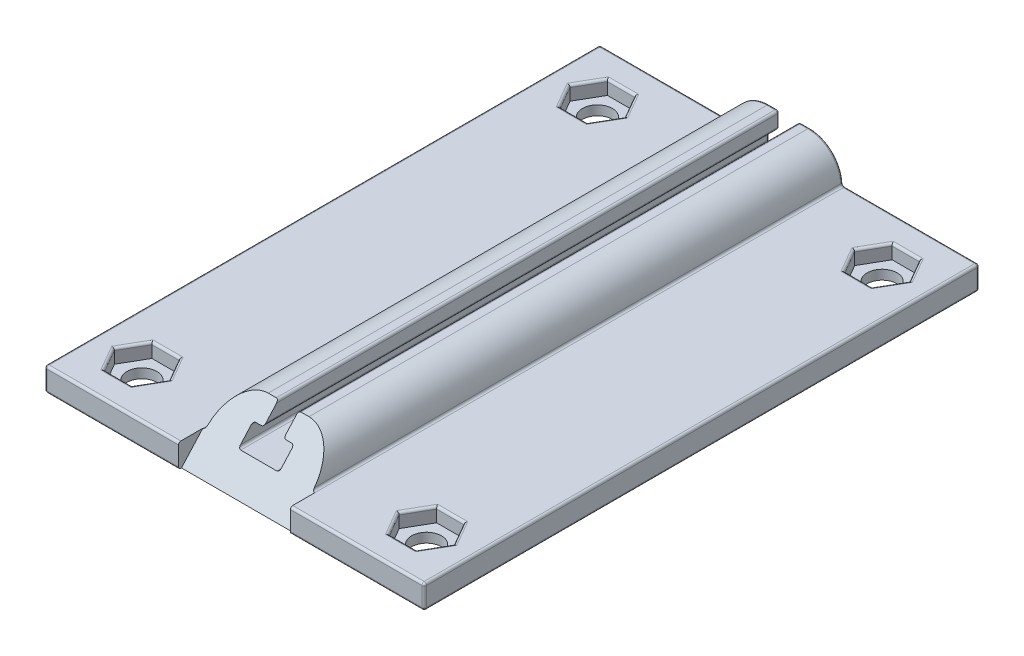
from build123d import *

# Parameters (mm, degrees)
BOSS_EXTRUDE1_DEPTH      = 58.5
BOSS_EXTRUDE1_DEPTH_BACK = 58.5
SKETCH2_R                = 3.15
CUT_EXTRUDE1_DEPTH       = 58.5
FILLET1_R                = 0.5
CUT_EXTRUDE2_DEPTH       = 3
LPATTERN1_COUNT          = 2
LPATTERN1_PITCH          = 60
FILLET2_R                = 0.5
CUT_EXTRUDE3_DEPTH       = 13.88331
CUT_EXTRUDE3_DEPTH_BACK  = 9.68331


with BuildPart() as part:
    # Sketch1 → Boss-Extrude1 (new, two sides: drawn at the far end of the back side and taken through both)
    with BuildSketch(Plane.XY.offset(-BOSS_EXTRUDE1_DEPTH_BACK)):
        with BuildLine():
            Line((-40, -2.5), (40, -2.5))
            Line((40, -2.5), (40, 2.5))
            Line((40, 2.5), (11.3, 2.5))
            ThreePointArc((11.3, 2.5), (9.249747468, 7.449747468), (4.3, 9.5))
            Line((4.3, 9.5), (2.1, 9.5))
            Line((2.1, 9.5), (2.1, 6))
            Line((2.1, 6), (4.3, 6))
            Line((4.3, 6), (4.3, 2.5))
            Line((4.3, 2.5), (-4.3, 2.5))
            Line((-4.3, 2.5), (-4.3, 6))
            Line((-4.3, 6), (-2.1, 6))
            Line((-2.1, 6), (-2.1, 9.5))
            Line((-2.1, 9.5), (-4.3, 9.5))
            ThreePointArc((-4.3, 9.5), (-9.249747468, 7.449747468), (-11.3, 2.5))
            Line((-11.3, 2.5), (-40, 2.5))
            Line((-40, 2.5), (-40, -2.5))
        make_face()
    extrude(amount=BOSS_EXTRUDE1_DEPTH + BOSS_EXTRUDE1_DEPTH_BACK)

    # Sketch2 → Cut-Extrude1 (cut)
    with BuildSketch(Plane.XZ.offset(2.5)):
        with Locations(Location((-30, 48, 0), (0, 0, 270))):
            Circle(SKETCH2_R)
        with Locations(Location((30, 48, 0), (0, 0, 270))):
            Circle(SKETCH2_R)
        with Locations(Location((30, -48, 0), (0, 0, 270))):
            Circle(SKETCH2_R)
        with Locations(Location((-30, -48, 0), (0, 0, 270))):
            Circle(SKETCH2_R)
    extrude(amount=-CUT_EXTRUDE1_DEPTH, mode=Mode.SUBTRACT)

    # Fillet1
    fillet1_edges = [part.edges().sort_by_distance(p)[0] for p in [
        (-2.1, 7.75, -58.5),
        (-3.2, 9.5, -58.5),
        (-9.249747468, 7.449747468, -58.5),
        (-25.65, 2.5, -58.5),
        (-4.3, 2.5, 0),
        (4.3, 2.5, 0),
        (4.3, 6, 0),
        (2.1, 6, 0),
        (2.1, 9.5, 0),
        (11.3, 2.5, 0),
        (40, 2.5, 0),
        (40, -2.5, 0),
        (-40, -2.5, 0),
        (-40, 2.5, 0),
        (-11.3, 2.5, 0),
        (-2.1, 9.5, 0),
        (-2.1, 6, 0),
        (-4.3, 6, 0),
        (-40, 0, -58.5),
        (0, -2.5, -58.5),
        (40, 0, -58.5),
        (-3.2, 9.5, 58.5),
        (-25.65, 2.5, 58.5),
        (25.65, 2.5, -58.5),
        (-40, 0, 58.5),
        (25.65, 2.5, 58.5),
        (9.249747468, 7.449747468, 58.5),
        (2.1, 7.75, 58.5),
        (3.2, 6, 58.5),
        (4.3, 4.25, 58.5),
        (0, 2.5, 58.5),
        (9.249747468, 7.449747468, -58.5),
        (-4.3, 4.25, 58.5),
        (-3.2, 6, 58.5),
        (-2.1, 7.75, 58.5),
        (-9.249747468, 7.449747468, 58.5),
        (0, -2.5, 58.5),
        (40, 0, 58.5),
        (3.2, 9.5, 58.5),
        (3.2, 9.5, -58.5),
        (-4.3, 4.25, -58.5),
        (2.1, 7.75, -58.5),
        (3.2, 6, -58.5),
        (4.3, 4.25, -58.5),
        (0, 2.5, -58.5),
        (-30, 2.5, 51.15),
        (30, 2.5, -44.85),
        (-30, 2.5, -44.85),
        (30, 2.5, 51.15),
        (-3.2, 6, -58.5),
    ]]
    fillet(fillet1_edges, radius=FILLET1_R)

    # Sketch3 → Cut-Extrude2 (cut)
    with BuildSketch(Plane(origin=(0, 2.5, 0), x_dir=(1, 0, 0), z_dir=(0, 1, 0))):
        Polygon((-24.226497308, 48), (-27.113248654, 53), (-32.886751346, 53), (-35.773502692, 48), (-32.886751346, 43), (-27.113248654, 43), align=None)
        Polygon((-24.226497308, -48), (-27.113248654, -43), (-32.886751346, -43), (-35.773502692, -48), (-32.886751346, -53), (-27.113248654, -53), align=None)
    cut_extrude2 = extrude(amount=-CUT_EXTRUDE2_DEPTH, mode=Mode.SUBTRACT)

    # LPattern1: Cut-Extrude2 ×2
    with Locations(*[(i * LPATTERN1_PITCH, 0, 0) for i in range(1, LPATTERN1_COUNT)]):
        add(cut_extrude2, mode=Mode.SUBTRACT)

    # Fillet2
    fillet2_edges = [part.edges().sort_by_distance(p)[0] for p in [
        (-25.669872981, 2.5, -45.5),
        (-25.669872981, 2.5, -50.5),
        (-30, 2.5, -53),
        (-34.330127019, 2.5, -50.5),
        (-34.330127019, 2.5, -45.5),
        (-30, 2.5, -43),
        (-25.669872981, 2.5, 50.5),
        (-25.669872981, 2.5, 45.5),
        (-30, 2.5, 43),
        (-34.330127019, 2.5, 45.5),
        (-34.330127019, 2.5, 50.5),
        (-30, 2.5, 53),
        (34.330127019, 2.5, -45.5),
        (34.330127019, 2.5, -50.5),
        (30, 2.5, -53),
        (25.669872981, 2.5, -50.5),
        (25.669872981, 2.5, -45.5),
        (30, 2.5, -43),
        (34.330127019, 2.5, 50.5),
        (34.330127019, 2.5, 45.5),
        (30, 2.5, 43),
        (25.669872981, 2.5, 45.5),
        (25.669872981, 2.5, 50.5),
        (30, 2.5, 53),
    ]]
    fillet(fillet2_edges, radius=FILLET2_R)

    # Sketch6 → Cut-Extrude3 (cut, two sides: drawn at the far end of the back side and taken through both)
    with BuildSketch(Plane.ZY.offset(-2.1).offset(-CUT_EXTRUDE3_DEPTH_BACK)):
        Polygon((47.07, 9.5), (58.5, -3.2), (58.5, 9.5), align=None)
    extrude(amount=CUT_EXTRUDE3_DEPTH + CUT_EXTRUDE3_DEPTH_BACK, mode=Mode.SUBTRACT)


solid = part.part
